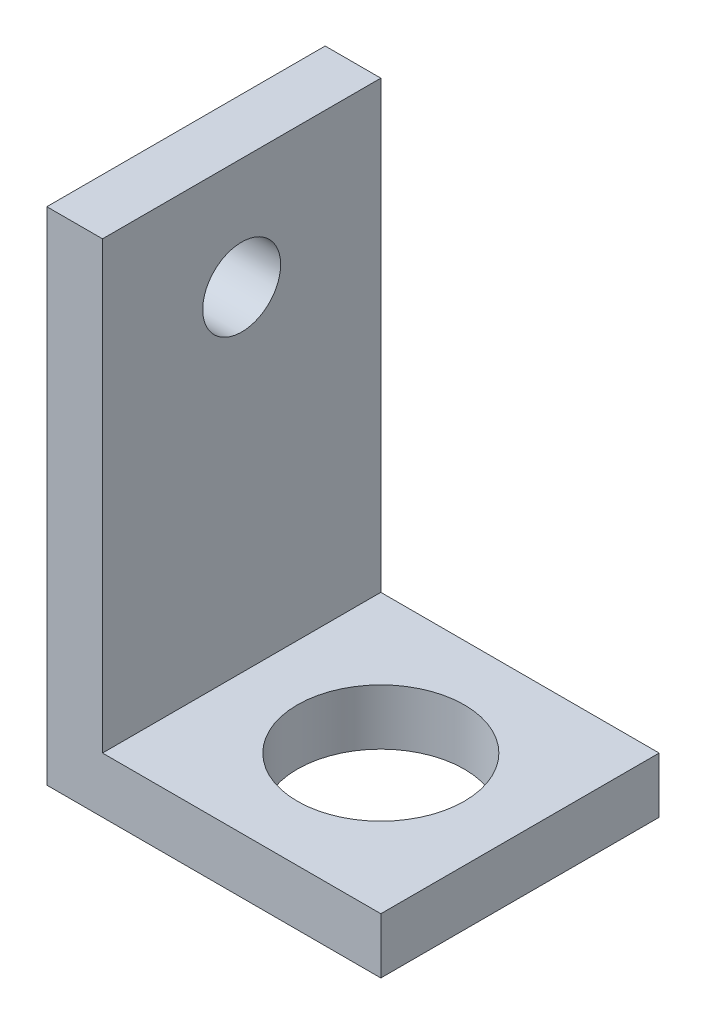
from build123d import *

# Parameters (mm, degrees)
EXTRUDE_THIN1_DEPTH = 50
SKETCH2_R           = 15
CUT_EXTRUDE1_DEPTH  = 107.77078252
SKETCH3_R           = 7
CUT_EXTRUDE2_DEPTH  = 107.77078252


with BuildPart() as part:
    # Sketch1 → Extrude-Thin1 (new body)
    with BuildSketch(Plane.XY):
        Polygon((0, 80), (0, 0), (50, 0), (50, -10), (-10, -10), (-10, 80), align=None)
    extrude(amount=EXTRUDE_THIN1_DEPTH)

    # Sketch2 → Cut-Extrude1 (cut, through all)
    with BuildSketch(Plane(origin=(0, 0, 0), x_dir=(1, 0, 0), z_dir=(0, 1, 0))):
        with Locations(Location((25, -25, 0), (0, 0, 270))):
            Circle(SKETCH2_R)
    extrude(amount=-CUT_EXTRUDE1_DEPTH, mode=Mode.SUBTRACT)

    # Sketch3 → Cut-Extrude2 (cut, through all)
    with BuildSketch(Plane(origin=(0, 0, 0), x_dir=(0, 0, -1), z_dir=(1, 0, 0))):
        with Locations((-25, 60)):
            Circle(SKETCH3_R)
    extrude(amount=-CUT_EXTRUDE2_DEPTH, mode=Mode.SUBTRACT)


solid = part.part
